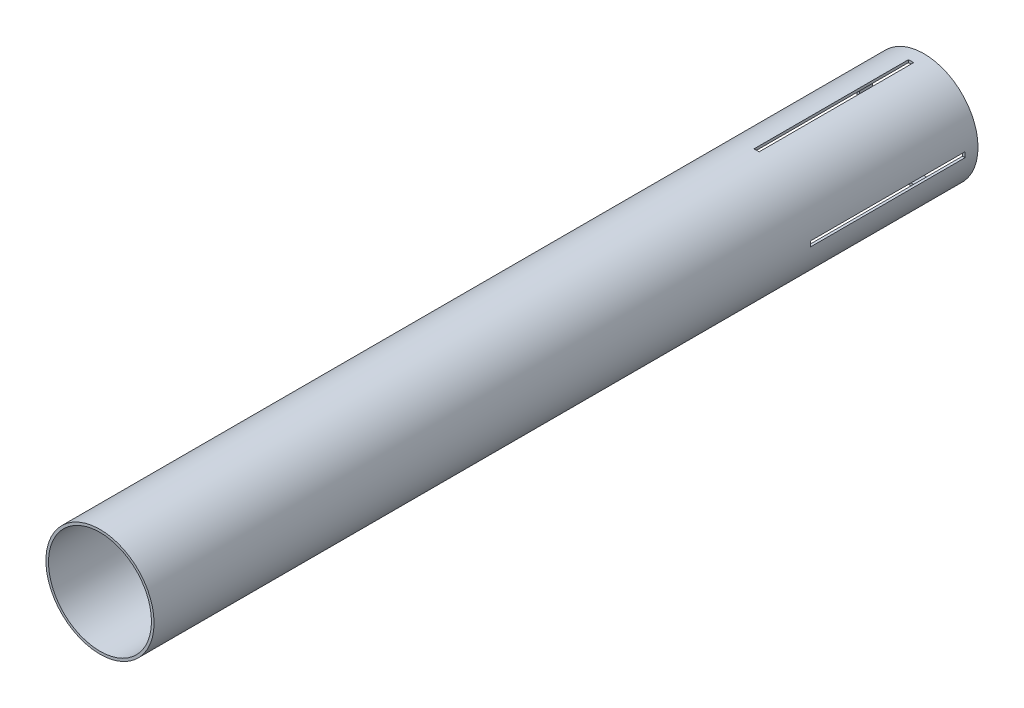
from build123d import *

# Parameters (mm, degrees)
SKETCH1_R           = 53.34
SKETCH1_R_2         = 50.8
BOSS_EXTRUDE1_DEPTH = 812.8
CUT_EXTRUDE1_REACH  = 818.293
SKETCH2_W           = 152.4
SKETCH2_H           = 5.08
CIRPATTERN1_COUNT   = 4


with BuildPart() as part:
    # Sketch1 → Boss-Extrude1 (new body)
    with BuildSketch(Plane.XY):
        Circle(SKETCH1_R)
        Circle(SKETCH1_R_2, mode=Mode.SUBTRACT)
    extrude(amount=BOSS_EXTRUDE1_DEPTH)

    # Sketch2 → Cut-Extrude1 (cut, up to next)
    with BuildSketch(Plane(origin=(0, 0, 0), x_dir=(0, 0, -1), z_dir=(1, 0, 0)), mode=Mode.PRIVATE) as cut_extrude1_sk1:
        with Locations((-88.9, 0)):
            Rectangle(SKETCH2_W, SKETCH2_H)
    cut_extrude1_tool1 = extrude(cut_extrude1_sk1.sketch, amount=-CUT_EXTRUDE1_REACH, mode=Mode.PRIVATE) & part.part
    cut_extrude1 = cut_extrude1_tool1.solids().sort_by_distance((0, 0, 88.9))[0]
    add(cut_extrude1, mode=Mode.SUBTRACT)

    # CirPattern1: Cut-Extrude1 ×4 about axis
    cirpattern1_axis = Axis((0, 0, -40.64), (0, 0, 1))
    for i in range(1, CIRPATTERN1_COUNT):
        add(cut_extrude1.rotate(cirpattern1_axis, i * 360 / CIRPATTERN1_COUNT), mode=Mode.SUBTRACT)


solid = part.part
